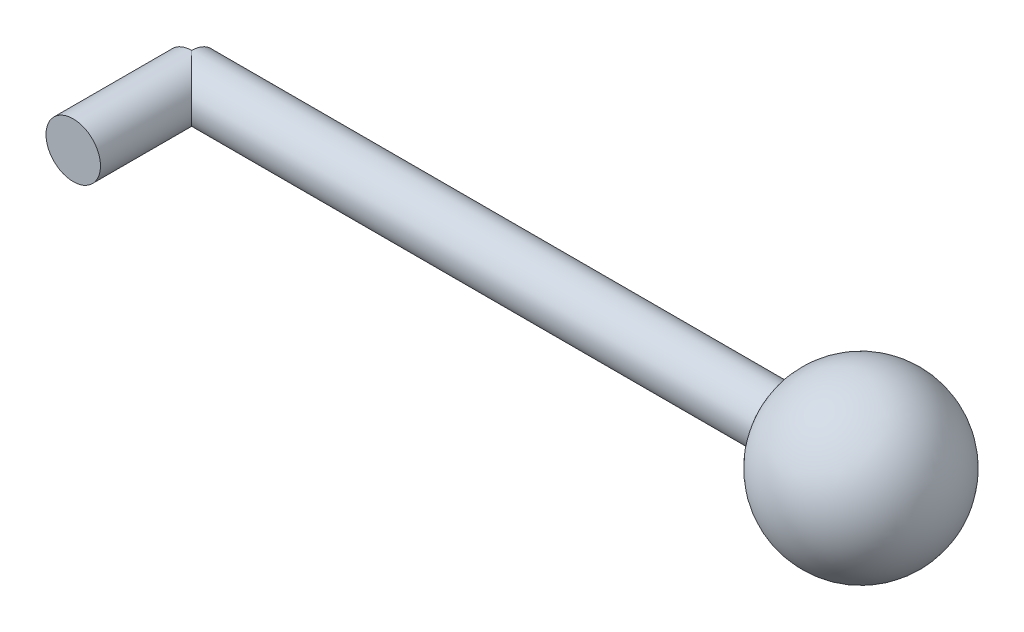
from build123d import *

# Parameters (mm, degrees)
SKETCH1_R       = 23
LENGTH_DEPTH    = 565
SKETCH2_R       = 23
HIP_JOINT_DEPTH = 100


with BuildPart() as part:
    # Sketch1 → Length (new body)
    with BuildSketch(Plane(origin=(0, 0, 0), x_dir=(0, 0, -1), z_dir=(1, 0, 0))):
        Circle(SKETCH1_R)
    extrude(amount=LENGTH_DEPTH)

    # Sketch2 → Hip joint (add)
    with BuildSketch(Plane.XY):
        with Locations(Location((0, 0, 0), (0, 0, 270))):
            Circle(SKETCH2_R)
    extrude(amount=HIP_JOINT_DEPTH)

    # Sketch10 → Revolve23 (revolve)
    with BuildSketch(Plane.XY):
        with BuildLine():
            Line((495, 0), (635, 0))
            ThreePointArc((635, 0), (565, -70), (495, 0))
        make_face()
    revolve(axis=Axis((565, 0, 0), (-1, 0, 0)))


solid = part.part
